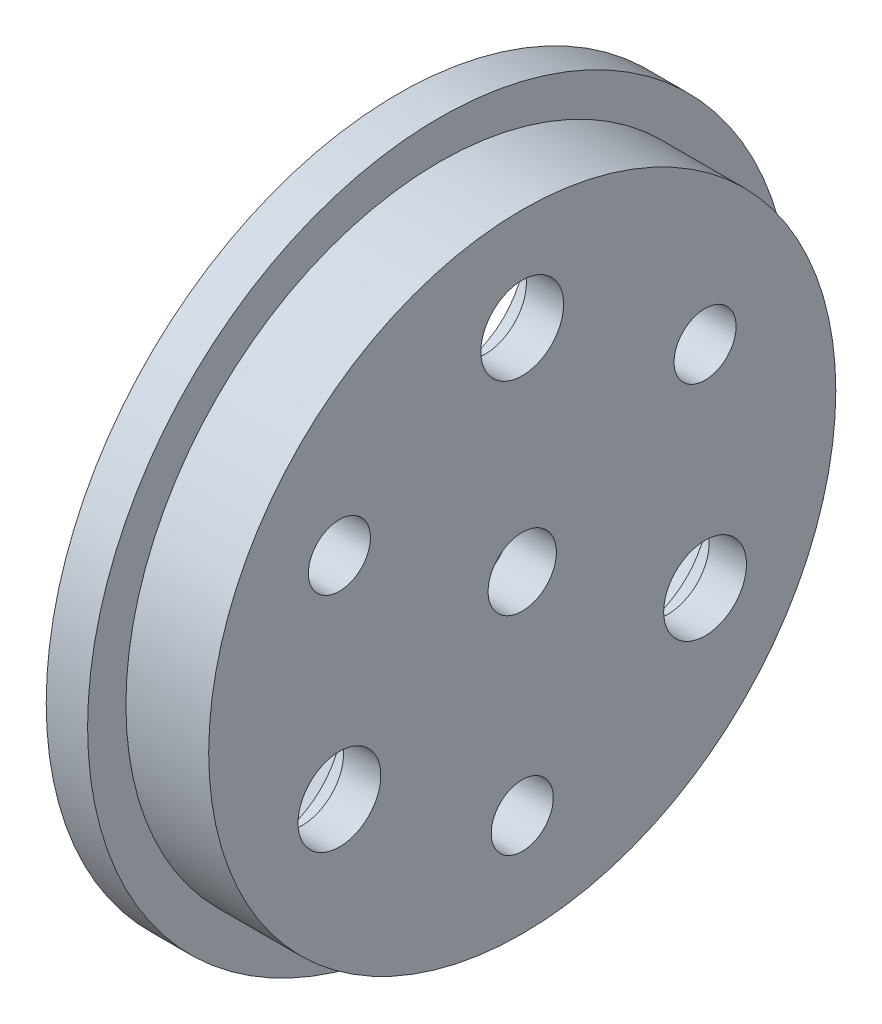
from build123d import *

# Parameters (mm, degrees)
SKETCH_4_R          = 17
EXTRUDE_2_DEPTH     = 2
SKETCH_5_R          = 15.15
EXTRUDE_3_DEPTH     = 4
CUT_EXTRUDE_1_DEPTH = 2.6
SKETCH_7_R          = 3.55
CUT_EXTRUDE_2_DEPTH = 1.6
SKETCH_8_R          = 2
CUT_EXTRUDE_3_DEPTH = 25.280856657
SKETCH_9_R          = 5.5
CUT_EXTRUDE_4_DEPTH = 1.1
SKETCH_11_R         = 1.65
CUT_EXTRUDE_5_DEPTH = 25.324678826
SKETCH_13_R         = 1.5
CUT_EXTRUDE_6_DEPTH = 25.779023387


with BuildPart() as part:
    # 草图4 → 凸台-拉伸2 (new body)
    with BuildSketch(Plane(origin=(0, 0, 0), x_dir=(0, 0, -1), z_dir=(1, 0, 0))):
        Circle(SKETCH_4_R)
    extrude(amount=EXTRUDE_2_DEPTH)

    # 草图5 → 凸台-拉伸3 (add)
    with BuildSketch(Plane(origin=(2, 0, 0), x_dir=(0, 0, -1), z_dir=(1, 0, 0))):
        Circle(SKETCH_5_R)
    extrude(amount=EXTRUDE_3_DEPTH)

    # 草图6 → 切除-拉伸1 (cut)
    with BuildSketch(Plane.ZY):
        with BuildLine():
            Line((-3.031088913, 12.75), (-12.557368355, -3.75))
            ThreePointArc((-12.557368355, -3.75), (-12.557368355, -7.25), (-9.526279442, -9))
            Line((-9.526279442, -9), (9.526279442, -9))
            ThreePointArc((9.526279442, -9), (12.557368355, -7.25), (12.557368355, -3.75))
            Line((12.557368355, -3.75), (3.031088913, 12.75))
            ThreePointArc((3.031088913, 12.75), (0, 14.5), (-3.031088913, 12.75))
        make_face()
    extrude(amount=-CUT_EXTRUDE_1_DEPTH, mode=Mode.SUBTRACT)

    # 草图7 → 切除-拉伸2 (cut)
    with BuildSketch(Plane.ZY.offset(-2.6)):
        with Locations((0, 10.2)):
            Circle(SKETCH_7_R)
        with Locations((8.833459119, -5.1)):
            Circle(SKETCH_7_R)
        with Locations((-8.833459119, -5.1)):
            Circle(SKETCH_7_R)
    extrude(amount=-CUT_EXTRUDE_2_DEPTH, mode=Mode.SUBTRACT)

    # 草图8 → 切除-拉伸3 (cut, through all)
    with BuildSketch(Plane.ZY.offset(-2.6)):
        with Locations((0, 10.2)):
            Circle(SKETCH_8_R)
        with Locations((8.833459119, -5.1)):
            Circle(SKETCH_8_R)
        with Locations((-8.833459119, -5.1)):
            Circle(SKETCH_8_R)
    extrude(amount=-CUT_EXTRUDE_3_DEPTH, mode=Mode.SUBTRACT)

    # 草图9 → 切除-拉伸4 (cut)
    with BuildSketch(Plane.ZY.offset(-2.6)):
        Circle(SKETCH_9_R)
    extrude(amount=-CUT_EXTRUDE_4_DEPTH, mode=Mode.SUBTRACT)

    # 草图11 → 切除-拉伸5 (cut, through all)
    with BuildSketch(Plane.ZY.offset(-3.7)):
        Circle(SKETCH_11_R)
    extrude(amount=-CUT_EXTRUDE_5_DEPTH, mode=Mode.SUBTRACT)

    # 草图13 → 切除-拉伸6 (cut, through all)
    with BuildSketch(Plane(origin=(6, 0, 0), x_dir=(0, 0, -1), z_dir=(1, 0, 0))):
        with Locations((-8.833459119, 5.1)):
            Circle(SKETCH_13_R)
        with Locations((8.833459119, 5.1)):
            Circle(SKETCH_13_R)
        with Locations((0, -10.2)):
            Circle(SKETCH_13_R)
    extrude(amount=-CUT_EXTRUDE_6_DEPTH, mode=Mode.SUBTRACT)


solid = part.part
